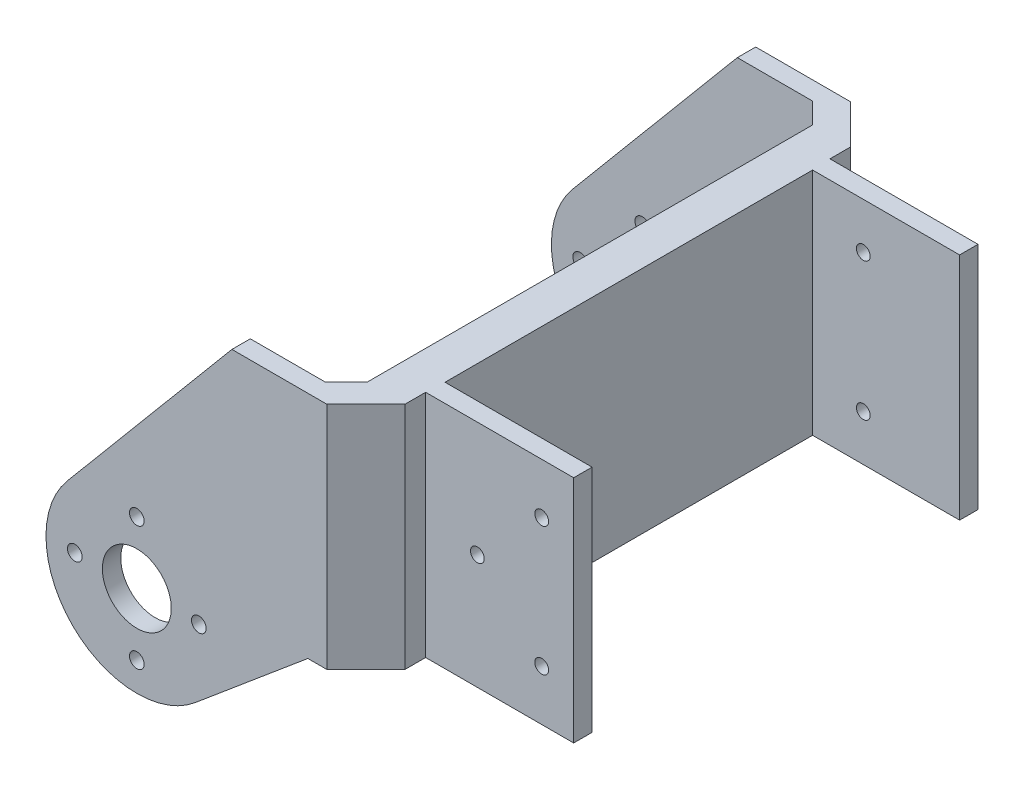
from build123d import *

# Parameters (mm, degrees)
EXTRUDE_1_DEPTH                 = 25
CUT_EXTRUDE_1_REACH             = 54.692
SKETCH_2_R                      = 0.75
CUT_EXTRUDE_1_DIRECTION_2_DEPTH = 53.691808082
EXTRUDE_2_DEPTH                 = 25
EXTRUDE_3_DEPTH                 = 2
CUT_EXTRUDE_4_DEPTH             = 73.027407742
CUT_EXTRUDE_4_DEPTH_BACK        = 73.027407742
SKETCH_6_R                      = 3.75
SKETCH_6_R_2                    = 0.8
CUT_EXTRUDE_START               = -44
SKETCH_8_R                      = 0.75
CUT_EXTRUDE_5_DEPTH             = 2


with BuildPart() as part:
    # 草图1 → 凸台-拉伸1 (new body)
    with BuildSketch(Plane(origin=(0, 0, 0), x_dir=(1, 0, 0), z_dir=(0, 1, 0))):
        Polygon((14.677419355, 32.709677419), (-1.322580645, 32.709677419), (-1.322580645, -7.290322581), (14.677419355, -7.290322581), (14.677419355, -9.290322581), (-3.322580645, -9.290322581), (-3.322580645, 34.709677419), (14.677419355, 34.709677419), align=None)
    extrude(amount=EXTRUDE_1_DEPTH)

    # 草图2 → 切除-拉伸1 (cut, up to next)
    with BuildSketch(Plane.XY.offset(9.290322581), mode=Mode.PRIVATE) as cut_extrude_1_sk1:
        with Locations(Location((4.195809336, 12.5, 0), (0, 0, 180))):
            Circle(SKETCH_2_R)
    cut_extrude_1_tool1 = extrude(cut_extrude_1_sk1.sketch, amount=-CUT_EXTRUDE_1_REACH, mode=Mode.PRIVATE) & part.part
    # 草图2 → 切除-拉伸1 (cut, up to next)
    with BuildSketch(Plane.XY.offset(9.290322581), mode=Mode.PRIVATE) as cut_extrude_1_sk2:
        with Locations(Location((11.195809336, 19.5, 0), (0, 0, 180))):
            Circle(SKETCH_2_R)
    cut_extrude_1_tool2 = extrude(cut_extrude_1_sk2.sketch, amount=-CUT_EXTRUDE_1_REACH, mode=Mode.PRIVATE) & part.part
    # 草图2 → 切除-拉伸1 (cut, up to next)
    with BuildSketch(Plane.XY.offset(9.290322581), mode=Mode.PRIVATE) as cut_extrude_1_sk3:
        with Locations(Location((11.195809336, 5.5, 0), (0, 0, 180))):
            Circle(SKETCH_2_R)
    cut_extrude_1_tool3 = extrude(cut_extrude_1_sk3.sketch, amount=-CUT_EXTRUDE_1_REACH, mode=Mode.PRIVATE) & part.part
    add(cut_extrude_1_tool1.solids().sort_by_distance((4.195809, 12.5, 9.290323))[0], mode=Mode.SUBTRACT)
    add(cut_extrude_1_tool2.solids().sort_by_distance((11.195809, 19.5, 9.290323))[0], mode=Mode.SUBTRACT)
    add(cut_extrude_1_tool3.solids().sort_by_distance((11.195809, 5.5, 9.290323))[0], mode=Mode.SUBTRACT)

    # 草图2 → 切除-拉伸1 direction 2 (cut)
    with BuildSketch(Plane.XY.offset(9.290322581)):
        with Locations(Location((4.195809336, 12.5, 0), (0, 0, 180))):
            Circle(SKETCH_2_R)
        with Locations(Location((11.195809336, 19.5, 0), (0, 0, 180))):
            Circle(SKETCH_2_R)
        with Locations(Location((11.195809336, 5.5, 0), (0, 0, 180))):
            Circle(SKETCH_2_R)
    extrude(amount=CUT_EXTRUDE_1_DIRECTION_2_DEPTH, mode=Mode.SUBTRACT)

    # 草图5 → 凸台-拉伸2 (add)
    with BuildSketch(Plane(origin=(0, 25, 0), x_dir=(1, 0, 0), z_dir=(0, 1, 0))):
        Polygon((-3.682839685, 39.209677419), (-1.432839685, 36.959677419), (-1.432839685, 34.709677419), (-3.322580645, 34.709677419), (-3.322580645, 32.459677419), (-3.322580645, 12.709677419), (-5.572580645, 12.709677419), (-5.572580645, 32.459677419), (-5.572580645, 36.959677419), (-7.822580645, 39.209677419), (-16.014767983, 39.209677419), (-16.014767983, 41.209677419), (-5.682839685, 41.209677419), align=None)
    extrude_2 = extrude(amount=-EXTRUDE_2_DEPTH)

    # 镜向1: 凸台-拉伸2 across plane
    add(extrude_2.mirror(Plane.XY.offset(-12.709677419)))

    # 草图7 → 凸台-拉伸3 (add)
    with BuildSketch(Plane(origin=(0, 0, -41.209677419), x_dir=(-1, 0, 0), z_dir=(0, 0, -1))):
        with BuildLine():
            Line((16.014767983, 25), (33.935605331, 3.642777708))
            ThreePointArc((33.935605331, 3.642777708), (33.352966922, -9.701835828), (20.008353386, -10.284474238))
            Line((20.008353386, -10.284474238), (7.751794264, 0))
            Line((7.751794264, 0), (16.014767983, 0))
            Line((16.014767983, 0), (16.014767983, 25))
        make_face()
    extrude_3 = extrude(amount=-EXTRUDE_3_DEPTH)

    # 镜向5: 凸台-拉伸3 across plane
    add(extrude_3.mirror(Plane.XY.offset(-12.709677419)))

    # 草图6 → 切除-拉伸4 (cut, two sides: drawn at the far end of the back side and taken through both)
    with BuildSketch(Plane(origin=(0, 0, -41.209677419), x_dir=(-1, 0, 0), z_dir=(0, 0, -1)).offset(-CUT_EXTRUDE_4_DEPTH_BACK)):
        with Locations((26.362741029, -2.711609936)):
            Circle(SKETCH_6_R)
        with Locations((33.112741029, -2.711609936)):
            Circle(SKETCH_6_R_2)
        with Locations((26.362741029, 4.038390064)):
            Circle(SKETCH_6_R_2)
        with Locations((19.612741029, -2.711609936)):
            Circle(SKETCH_6_R_2)
        with Locations((26.362741029, -9.461609936)):
            Circle(SKETCH_6_R_2)
    extrude(amount=CUT_EXTRUDE_4_DEPTH + CUT_EXTRUDE_4_DEPTH_BACK, mode=Mode.SUBTRACT)

    # 草图8 → 切除-拉伸5 (cut)
    with BuildSketch(Plane.XY.offset(9.290322581).offset(CUT_EXTRUDE_START)):
        with Locations((4.195809336, 20)):
            Circle(SKETCH_8_R)
        with Locations((4.195809336, 5)):
            Circle(SKETCH_8_R)
    extrude(amount=CUT_EXTRUDE_5_DEPTH, mode=Mode.SUBTRACT)


solid = part.part
